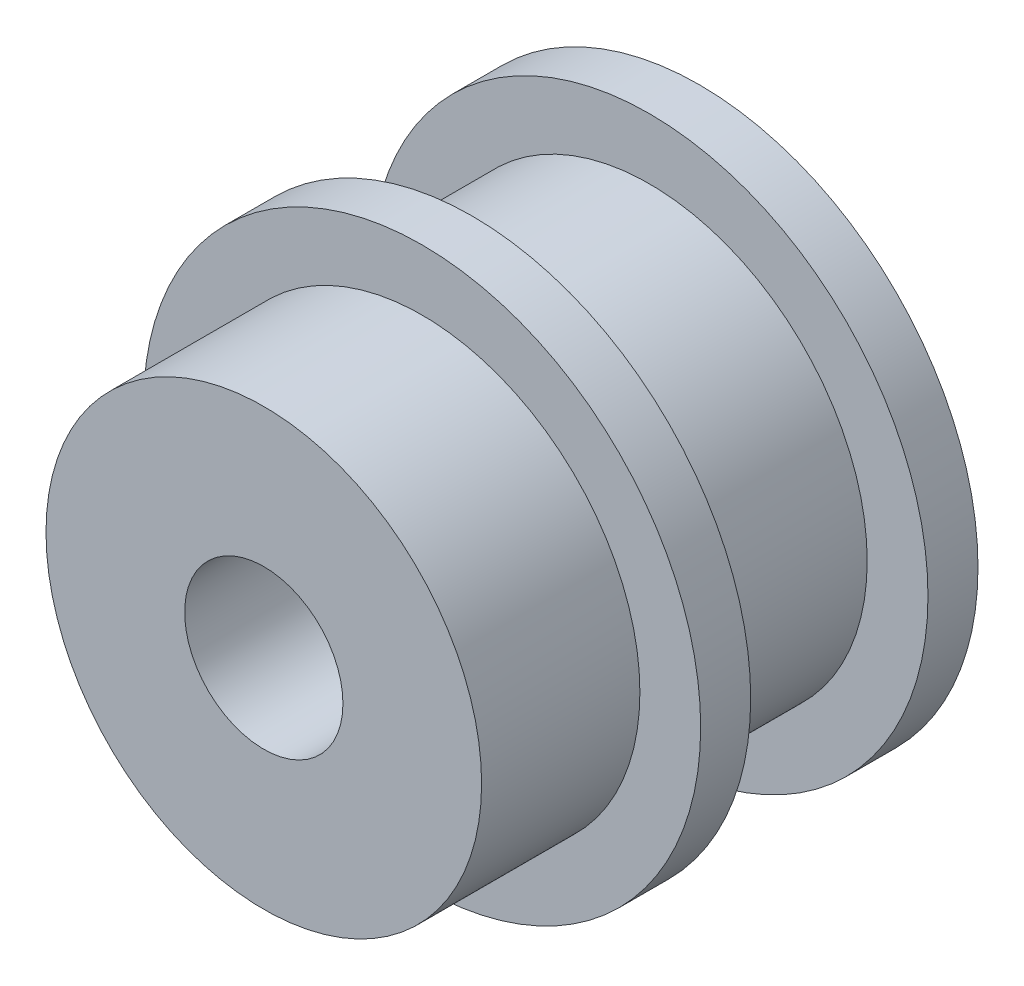
from build123d import *


with BuildPart() as part:
    # Sketch1 → Revolve5 (revolve)
    with BuildSketch(Plane(origin=(0, 0, 0), x_dir=(0, 0, -1), z_dir=(1, 0, 0)), mode=Mode.PRIVATE) as revolve5_sk:
        Polygon((0, 8.7376), (0, 3.175), (17.4752, 3.175), (17.4752, 11.176), (15.4686, 11.176), (15.4686, 8.7376), (8.3566, 8.7376), (8.3566, 11.176), (6.35, 11.176), (6.35, 8.7376), align=None)
    revolve(revolve5_sk.sketch.rotate(Axis((0, 0, 0), (0, 0, -1)), 90), axis=Axis((0, 0, 0), (0, 0, -1)))


solid = part.part
